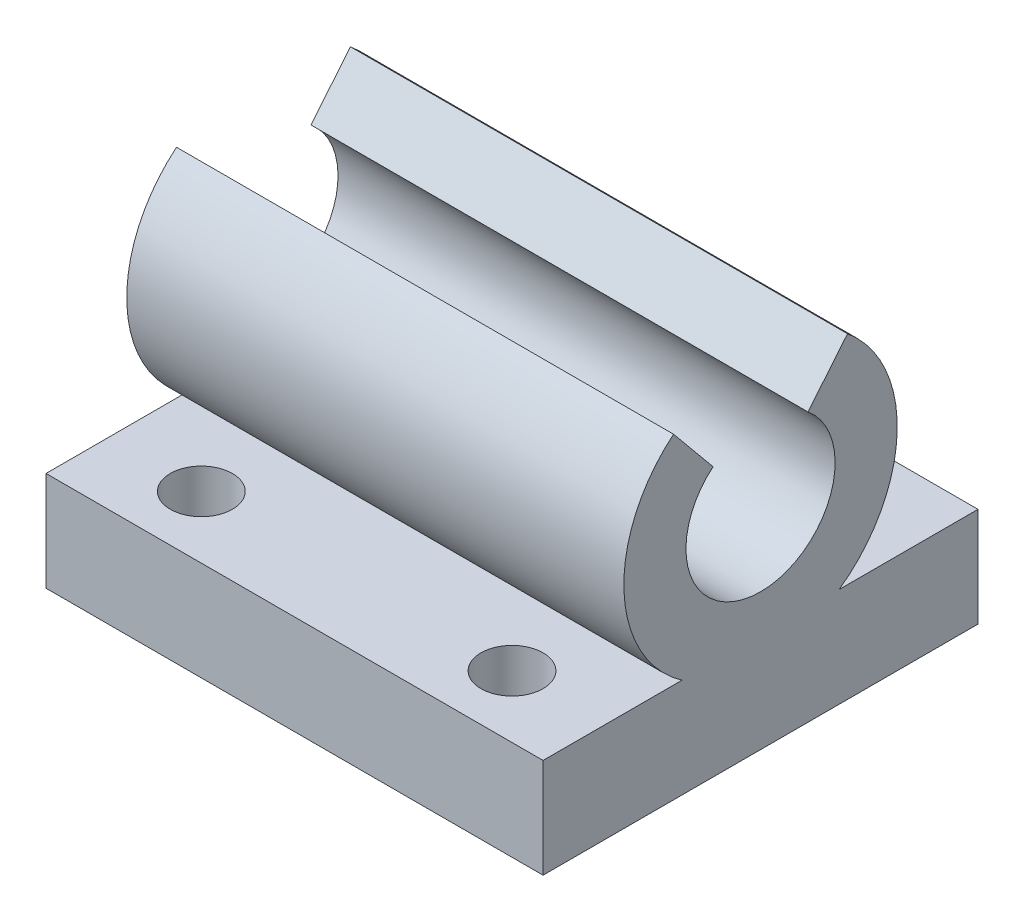
from build123d import *

# Parameters (mm, degrees)
EXTRUDE_1_DEPTH     = 20
CUT_EXTRUDE_1_REACH = 38.821
SKETCH_3_R          = 2.5


with BuildPart() as part:
    # Эскиз2 → Бобышка-Вытянуть1 (new, symmetric)
    with BuildSketch(Plane(origin=(0, 0, 0), x_dir=(0, 0, -1), z_dir=(1, 0, 0))):
        with BuildLine():
            Line((-3.818181818, 21.628335295), (-7, 25.485281374))
            ThreePointArc((-7, 25.485281374), (-10.991801936, 16.575394071), (-6.32455532, 8))
            Line((-6.32455532, 8), (-17.5, 8))
            Line((-17.5, 8), (-17.5, 0))
            Line((-17.5, 0), (17.5, 0))
            Line((17.5, 0), (17.5, 8))
            Line((17.5, 8), (6.32455532, 8))
            ThreePointArc((6.32455532, 8), (10.991801936, 16.575394071), (7, 25.485281374))
            Line((7, 25.485281374), (3.818181818, 21.628335295))
            ThreePointArc((3.818181818, 21.628335295), (0, 11), (-3.818181818, 21.628335295))
        make_face()
    extrude(amount=EXTRUDE_1_DEPTH, both=True)

    # Эскиз3 → Вырез-Вытянуть1 (cut, up to next)
    with BuildSketch(Plane.XZ, mode=Mode.PRIVATE) as cut_extrude_1_sk1:
        with Locations(Location((-12.5, 12.5, 0), (0, 0, 270))):
            Circle(SKETCH_3_R)
    cut_extrude_1_tool1 = extrude(cut_extrude_1_sk1.sketch, amount=-CUT_EXTRUDE_1_REACH, mode=Mode.PRIVATE) & part.part
    # Эскиз3 → Вырез-Вытянуть1 (cut, up to next)
    with BuildSketch(Plane.XZ, mode=Mode.PRIVATE) as cut_extrude_1_sk2:
        with Locations(Location((12.5, 12.5, 0), (0, 0, 270))):
            Circle(SKETCH_3_R)
    cut_extrude_1_tool2 = extrude(cut_extrude_1_sk2.sketch, amount=-CUT_EXTRUDE_1_REACH, mode=Mode.PRIVATE) & part.part
    # Эскиз3 → Вырез-Вытянуть1 (cut, up to next)
    with BuildSketch(Plane.XZ, mode=Mode.PRIVATE) as cut_extrude_1_sk3:
        with Locations(Location((-12.5, -12.5, 0), (0, 0, 270))):
            Circle(SKETCH_3_R)
    cut_extrude_1_tool3 = extrude(cut_extrude_1_sk3.sketch, amount=-CUT_EXTRUDE_1_REACH, mode=Mode.PRIVATE) & part.part
    # Эскиз3 → Вырез-Вытянуть1 (cut, up to next)
    with BuildSketch(Plane.XZ, mode=Mode.PRIVATE) as cut_extrude_1_sk4:
        with Locations(Location((12.5, -12.5, 0), (0, 0, 270))):
            Circle(SKETCH_3_R)
    cut_extrude_1_tool4 = extrude(cut_extrude_1_sk4.sketch, amount=-CUT_EXTRUDE_1_REACH, mode=Mode.PRIVATE) & part.part
    add(cut_extrude_1_tool1.solids().sort_by_distance((-12.5, 0, 12.5))[0], mode=Mode.SUBTRACT)
    add(cut_extrude_1_tool2.solids().sort_by_distance((12.5, 0, 12.5))[0], mode=Mode.SUBTRACT)
    add(cut_extrude_1_tool3.solids().sort_by_distance((-12.5, 0, -12.5))[0], mode=Mode.SUBTRACT)
    add(cut_extrude_1_tool4.solids().sort_by_distance((12.5, 0, -12.5))[0], mode=Mode.SUBTRACT)


solid = part.part
